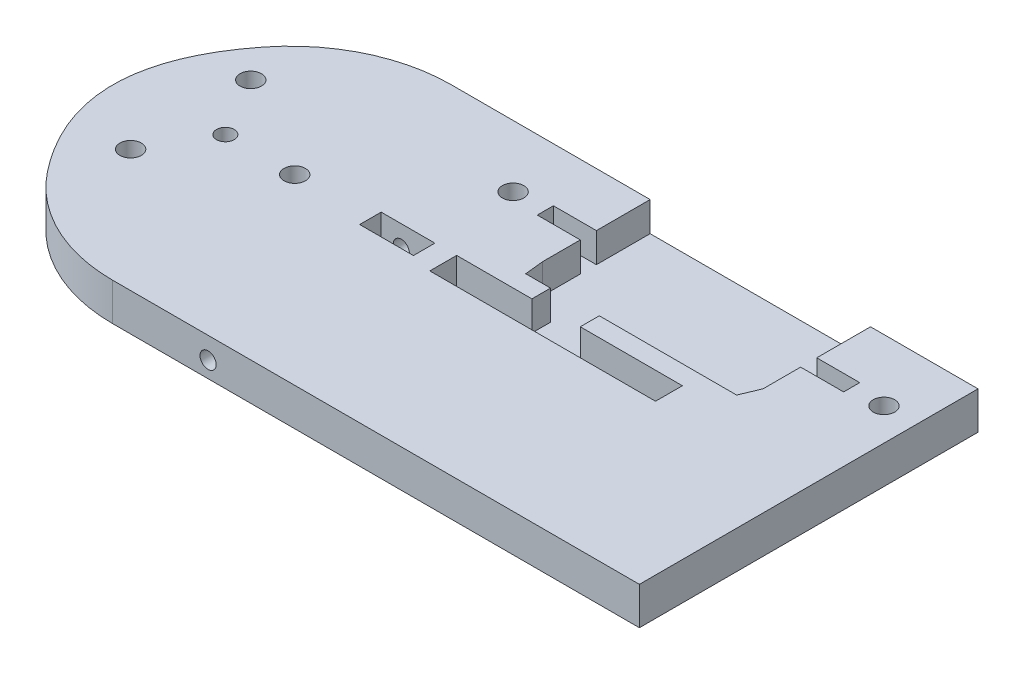
from build123d import *

# Parameters (mm, degrees)
BOSS_EXTRU_1_DEPTH      = 7
ENL_V_MAT_EXTRU_1_DEPTH = 5.5
ESQUISSE3_W             = 42
ESQUISSE3_H             = 5
ENL_V_MAT_EXTRU_2_DEPTH = 7
ESQUISSE4_R             = 2
ENL_V_MAT_EXTRU_3_DEPTH = 7
ESQUISSE5_W             = 8
ESQUISSE5_H             = 4
ENL_V_MAT_EXTRU_4_DEPTH = 7
CHANFREIN1_SIZE         = 2
CHANFREIN1_SIZE2        = 2.22122503
ESQUISSE6_R             = 2
ESQUISSE6_R_2           = 1.65
ENL_V_MAT_EXTRU_5_DEPTH = 7
ESQUISSE7_R             = 1.5
ENL_V_MAT_EXTRU_6_DEPTH = 67
CONG_1_R                = 30


with BuildPart() as part:
    # Esquisse1 → Boss.-Extru.1 (new body)
    with BuildSketch(Plane(origin=(0, 0, 0), x_dir=(1, 0, 0), z_dir=(0, 1, 0))):
        with BuildLine():
            Line((0, 0), (110, 0))
            Line((110, 0), (110, 63))
            Line((110, 63), (0, 63))
            add(Edge.make_bspline(
                [(0, 63), (-38.954434005, 31.5), (0, 0)],
                knots=[0, 0, 0, 1, 1, 1], degree=2))
        make_face()
    extrude(amount=BOSS_EXTRU_1_DEPTH)

    # Esquisse2 → Enlèv. mat.-Extru.1 (cut)
    with BuildSketch(Plane(origin=(0, 7, 0), x_dir=(1, 0, 0), z_dir=(0, 1, 0))):
        Polygon((90, 63), (90, 53), (98, 53), (98, 50), (90, 50), (90, 43), (88.548308046, 39.540825664), (63, 39.540825664), (63, 35.886046781), (54, 35.886046781), (54, 39.466527525), (49.383125702, 39.466527525), (49, 43), (49, 50), (41, 50), (41, 53), (49, 53), (49, 63), align=None)
    extrude(amount=-ENL_V_MAT_EXTRU_1_DEPTH, mode=Mode.SUBTRACT)

    # Esquisse3 → Enlèv. mat.-Extru.2 (cut)
    with BuildSketch(Plane(origin=(0, 7, 0), x_dir=(1, 0, 0), z_dir=(0, 1, 0))):
        with Locations((61, 33.5)):
            Rectangle(ESQUISSE3_W, ESQUISSE3_H)
    extrude(amount=-ENL_V_MAT_EXTRU_2_DEPTH, mode=Mode.SUBTRACT)

    # Esquisse4 → Enlèv. mat.-Extru.3 (cut)
    with BuildSketch(Plane(origin=(0, 7, 0), x_dir=(1, 0, 0), z_dir=(0, 1, 0))):
        with Locations(Location((104, 51.5, 0), (0, 0, 270))):
            Circle(ESQUISSE4_R)
        with Locations(Location((35, 51.5, 0), (0, 0, 270))):
            Circle(ESQUISSE4_R)
    extrude(amount=-ENL_V_MAT_EXTRU_3_DEPTH, mode=Mode.SUBTRACT)

    # Esquisse5 → Enlèv. mat.-Extru.4 (cut)
    with BuildSketch(Plane(origin=(0, 7, 0), x_dir=(1, 0, 0), z_dir=(0, 1, 0))):
        with Locations((30, 33.95274738)):
            Rectangle(ESQUISSE5_W, ESQUISSE5_H)
    extrude(amount=-ENL_V_MAT_EXTRU_4_DEPTH, mode=Mode.SUBTRACT)

    # Chanfrein1
    chanfrein1_edges = [part.edges().sort_by_distance(p)[0] for p in [
        (34, 7, -33.95274738),
    ]]
    chanfrein1_side = [part.faces().sort_by_distance(p)[0] for p in [
        (44.621272822, 7, -28.216818426),
    ]]
    chamfer(chanfrein1_edges, length=CHANFREIN1_SIZE, length2=CHANFREIN1_SIZE2, reference=chanfrein1_side[0])

    # Esquisse6 → Enlèv. mat.-Extru.5 (cut)
    with BuildSketch(Plane(origin=(0, 7, 0), x_dir=(1, 0, 0), z_dir=(0, 1, 0))):
        with Locations(Location((11.916860307, 33.95274738, 0), (0, 0, 270))):
            Circle(ESQUISSE6_R)
        with Locations(Location((-7.438807468, 45.12774738, 0), (0, 0, 270))):
            Circle(ESQUISSE6_R)
        with Locations(Location((-7.438807468, 22.77774738, 0), (0, 0, 270))):
            Circle(ESQUISSE6_R)
        with Locations(Location((-0.986918209, 33.95274738, 0), (0, 0, 270))):
            Circle(ESQUISSE6_R_2)
    extrude(amount=-ENL_V_MAT_EXTRU_5_DEPTH, mode=Mode.SUBTRACT)

    # Esquisse7 → Enlèv. mat.-Extru.6 (cut)
    with BuildSketch(Plane(origin=(0, 0, -63), x_dir=(-1, 0, 0), z_dir=(0, 0, -1))):
        with Locations((-29.749983128, 3)):
            Circle(ESQUISSE7_R)
    extrude(amount=-ENL_V_MAT_EXTRU_6_DEPTH, mode=Mode.SUBTRACT)

    # Congé1
    cong_1_edges = [part.edges().sort_by_distance(p)[0] for p in [
        (0, 3.5, 0),
        (0, 3.5, -63),
    ]]
    fillet(cong_1_edges, radius=CONG_1_R)


solid = part.part
